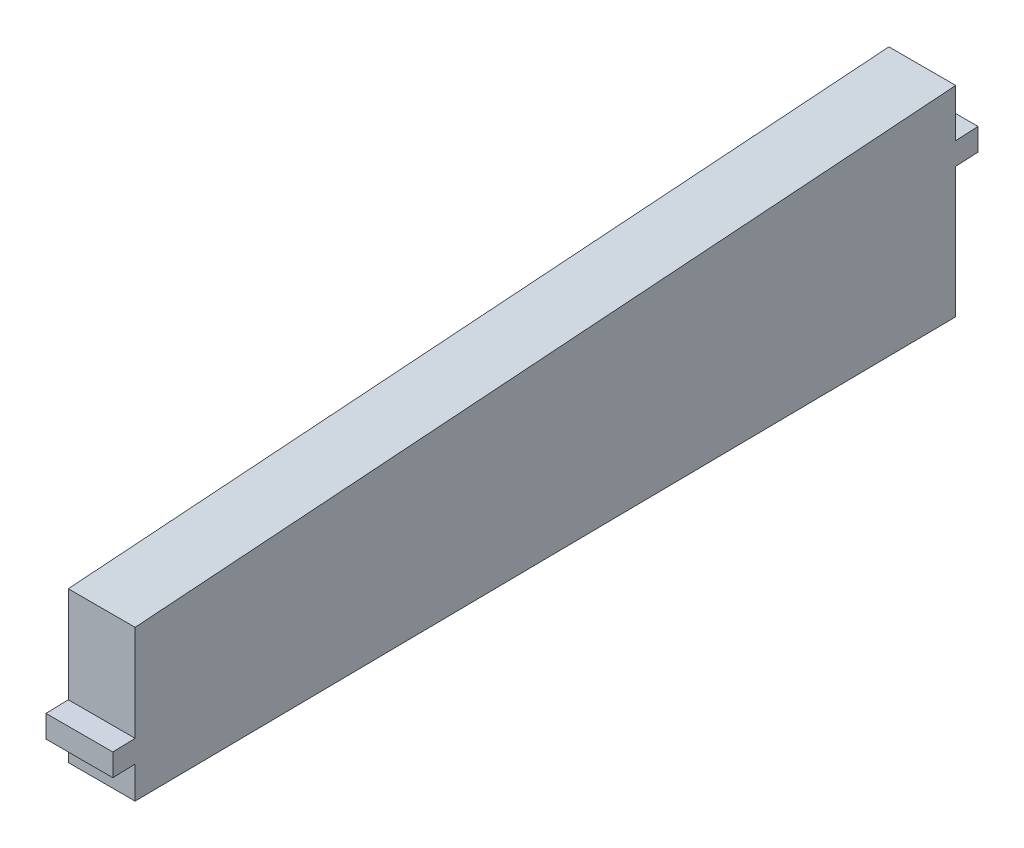
from build123d import *

# Parameters (mm, degrees)
BOSS_EXTRUDE1_DEPTH = 9.525


with BuildPart() as part:
    # Sketch1 → Boss-Extrude1 (new body)
    with BuildSketch(Plane(origin=(243.017706631, 0, 0), x_dir=(0, 0, -1), z_dir=(1, 0, 0))):
        Polygon((-1380.66036066, 362.833648863), (-1380.66036066, 359.658648863), (-1377.48536066, 359.754859582), (-1377.48536066, 355.176177259), (-1260.539527496, 356.485104863), (-1260.539527496, 375.049679307), (-1257.364527496, 375.21726965), (-1257.364527496, 378.39226965), (-1260.539527496, 378.224679307), (-1260.539527496, 385.038195502), (-1377.48536066, 376.630450656), (-1377.48536066, 362.929859582), align=None)
    extrude(amount=BOSS_EXTRUDE1_DEPTH)


solid = part.part
